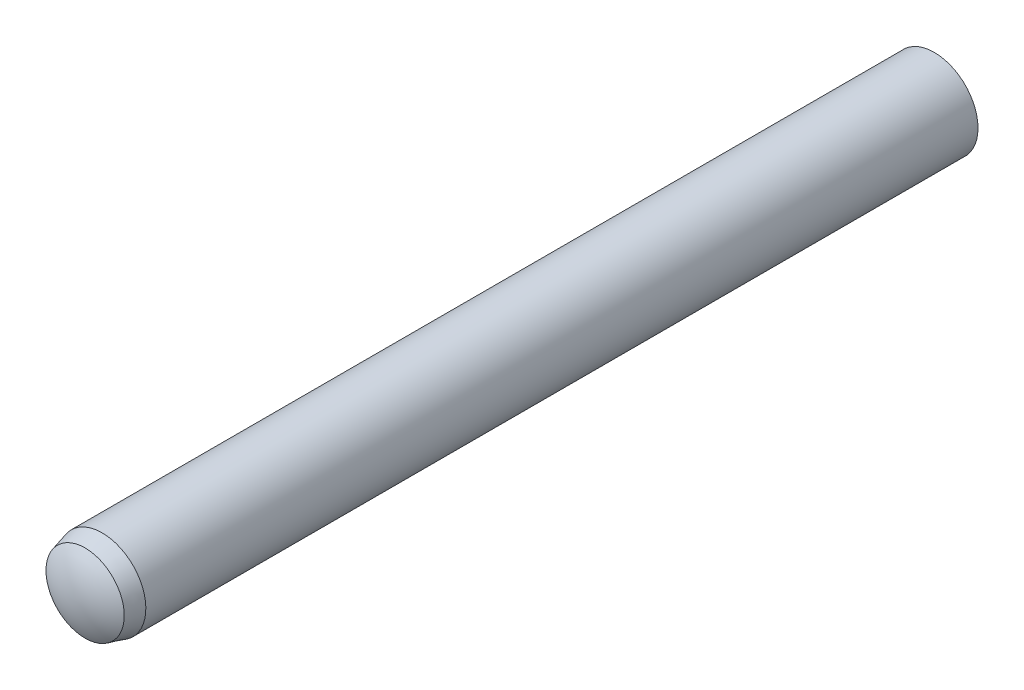
from build123d import *


with BuildPart() as part:
    # Sketch3 → Revolve1 (revolve)
    with BuildSketch(Plane(origin=(0, 0, 0), x_dir=(0, 0, -1), z_dir=(1, 0, 0))):
        with BuildLine():
            Line((-50, 0), (50, 0))
            ThreePointArc((50, 0), (49.616922091, 2.610076627), (48.5, 5))
            Line((48.5, 5), (-46.75, 5))
            Line((-46.75, 5), (-48.7, 4.477499075))
            ThreePointArc((-48.7, 4.477499075), (-49.668425132, 2.331201298), (-50, 0))
        make_face()
    revolve(axis=Axis((0, 0, 50), (0, 0, -1)))


solid = part.part
